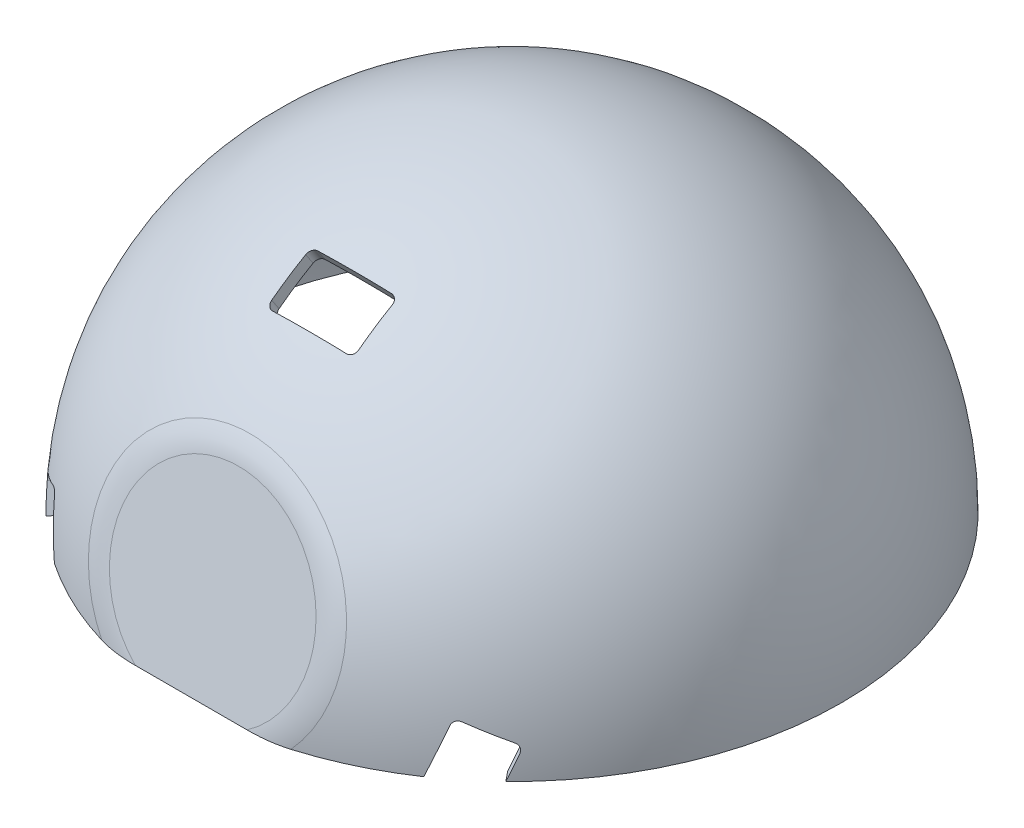
from build123d import *

# Parameters (mm, degrees)
ENL_V_MAT_EXTRU_2_DEPTH = 87.90564927
ENL_V_MAT_EXTRU_3_DEPTH = 87.90564927
ENL_V_MAT_EXTRU_4_DEPTH = 87.90564927
ESQUISSE9_R             = 50.102554111
ENL_V_MAT_EXTRU_5_DEPTH = 3
BOSS_EXTRU_1_DEPTH      = 2
CONG_1_R                = 10
ESQUISSE11_R            = 61.055888413
ENL_V_MAT_EXTRU_6_DEPTH = 10


with BuildPart() as part:
    # Esquisse1 → Révol.-Mince1 (revolve)
    with BuildSketch(Plane.XY):
        with BuildLine():
            ThreePointArc((50.175, 0), (35.479082746, 35.479082746), (0, 50.175))
            Line((0, 50.175), (0, 48.175))
            ThreePointArc((0, 48.175), (34.064869184, 34.064869184), (48.175, 0))
            Line((48.175, 0), (50.175, 0))
        make_face()
    revolve(axis=Axis((0, 0, 0), (0, 1, 0)))

    # Esquisse4 → Enlèv. mat.-Extru.2 (cut, through all)
    with BuildSketch(Plane(origin=(0, 0, 0), x_dir=(1, 0, 0), z_dir=(0, 0.8338858220671675, 0.5519369853120594))):
        with BuildLine():
            Line((-5.6, 4.1), (5.6, 4.1))
            ThreePointArc((5.6, 4.1), (6.307106781, 3.807106781), (6.6, 3.1))
            Line((6.6, 3.1), (6.6, -3.1))
            ThreePointArc((6.6, -3.1), (6.307106781, -3.807106781), (5.6, -4.1))
            Line((5.6, -4.1), (-5.6, -4.1))
            ThreePointArc((-5.6, -4.1), (-6.307106781, -3.807106781), (-6.6, -3.1))
            Line((-6.6, -3.1), (-6.6, 3.1))
            ThreePointArc((-6.6, 3.1), (-6.307106781, 3.807106781), (-5.6, 4.1))
        make_face()
    extrude(amount=ENL_V_MAT_EXTRU_2_DEPTH, mode=Mode.SUBTRACT)

    # Esquisse6 → Enlèv. mat.-Extru.3 (cut, through all)
    with BuildSketch(Plane(origin=(0, 0, 0), x_dir=(0, 1, 0), z_dir=(0.6314998264787698, 0, 0.7753760179147172))):
        with BuildLine():
            Line((6.742727455, 1.644878862), (-3.604723309, 5.930933305))
            ThreePointArc((-3.604723309, 5.930933305), (-4.370090174, 5.930933305), (-4.911286274, 5.389737204))
            Line((-4.911286274, 5.389737204), (-7.283923555, -0.338315897))
            ThreePointArc((-7.283923555, -0.338315897), (-7.283923555, -1.103682762), (-6.742727455, -1.644878862))
            Line((-6.742727455, -1.644878862), (3.604723309, -5.930933305))
            ThreePointArc((3.604723309, -5.930933305), (4.370090174, -5.930933305), (4.911286274, -5.389737204))
            Line((4.911286274, -5.389737204), (7.283923555, 0.338315897))
            ThreePointArc((7.283923555, 0.338315897), (7.283923555, 1.103682762), (6.742727455, 1.644878862))
        make_face()
    extrude(amount=ENL_V_MAT_EXTRU_3_DEPTH, mode=Mode.SUBTRACT)

    # Esquisse7 → Enlèv. mat.-Extru.4 (cut, through all)
    with BuildSketch(Plane(origin=(0, 0, 0), x_dir=(0, 1, 0), z_dir=(-0.6314998264787698, 0, 0.7753760179147172))):
        with BuildLine():
            Line((-6.742727455, 1.644878862), (3.604723309, 5.930933305))
            ThreePointArc((3.604723309, 5.930933305), (4.370090174, 5.930933305), (4.911286274, 5.389737204))
            Line((4.911286274, 5.389737204), (7.283923555, -0.338315897))
            ThreePointArc((7.283923555, -0.338315897), (7.283923555, -1.103682762), (6.742727455, -1.644878862))
            Line((6.742727455, -1.644878862), (-3.604723309, -5.930933305))
            ThreePointArc((-3.604723309, -5.930933305), (-4.370090174, -5.930933305), (-4.911286274, -5.389737204))
            Line((-4.911286274, -5.389737204), (-7.283923555, 0.338315897))
            ThreePointArc((-7.283923555, 0.338315897), (-7.283923555, 1.103682762), (-6.742727455, 1.644878862))
        make_face()
    extrude(amount=ENL_V_MAT_EXTRU_4_DEPTH, mode=Mode.SUBTRACT)

    # Esquisse9 → Enlèv. mat.-Extru.5 (cut)
    with BuildSketch(Plane(origin=(0, 12.986245588, 48.465328334), x_dir=(1, 0, 0), z_dir=(0, 0.25881904510251796, 0.9659258262890691))):
        Circle(ESQUISSE9_R)
    extrude(amount=-ENL_V_MAT_EXTRU_5_DEPTH, mode=Mode.SUBTRACT)

    # Esquisse10 → Boss.-Extru.1 (add)
    with BuildSketch(Plane(origin=(0, 12.209788453, 45.567550855), x_dir=(1, 0, 0), z_dir=(0, 0.25881904510251796, 0.9659258262890691))):
        with BuildLine():
            Line((-11.500768672, -12.640503153), (11.500768672, -12.640503153))
            ThreePointArc((11.500768672, -12.640503153), (0, 17.089470442), (-11.500768672, -12.640503153))
        make_face()
    extrude(amount=-BOSS_EXTRU_1_DEPTH)

    # Congé1
    cong_1_edges = [part.edges().sort_by_distance(p)[0] for p in [
        (0, 27.856623975, 39.304441552),
        (0, 28.716949311, 41.144470434),
    ]]
    fillet(cong_1_edges, radius=CONG_1_R)

    # Esquisse11 → Enlèv. mat.-Extru.6 (cut)
    with BuildSketch(Plane(origin=(0, 0, 0), x_dir=(1, 0, 0), z_dir=(0, 1, 0))):
        Circle(ESQUISSE11_R)
    extrude(amount=-ENL_V_MAT_EXTRU_6_DEPTH, mode=Mode.SUBTRACT)


solid = part.part
